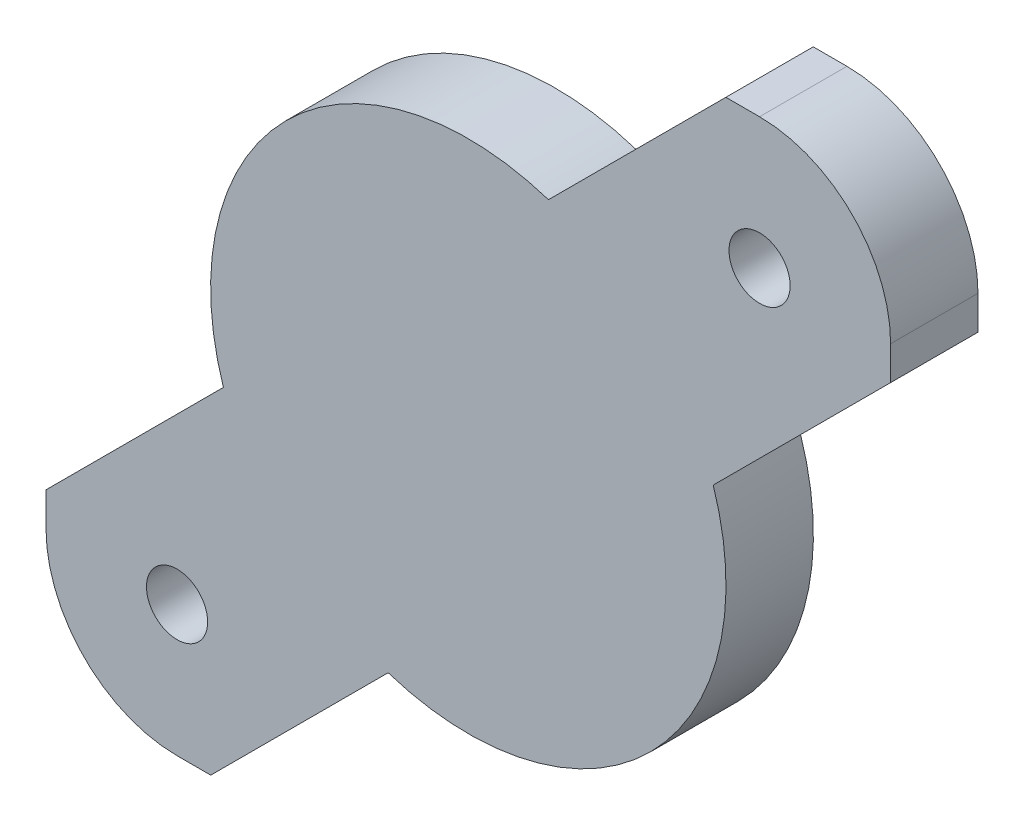
from build123d import *

# Parameters (mm, degrees)
SKETCH1_R           = 1.05
BOSS_EXTRUDE1_DEPTH = 3


with BuildPart() as part:
    # Sketch1 → Boss-Extrude1 (new body)
    with BuildSketch(Plane.XY):
        with BuildLine():
            Line((2.752454122, 8.409308372), (8.843145751, 14.5))
            Line((8.843145751, 14.5), (10, 14.5))
            ThreePointArc((10, 14.5), (13.181980515, 13.181980515), (14.5, 10))
            Line((14.5, 10), (14.5, 8.843145751))
            Line((14.5, 8.843145751), (8.409308372, 2.752454122))
            ThreePointArc((8.409308372, 2.752454122), (6.256695253, -6.256695253), (-2.752454122, -8.409308372))
            Line((-2.752454122, -8.409308372), (-8.843145751, -14.5))
            Line((-8.843145751, -14.5), (-10, -14.5))
            ThreePointArc((-10, -14.5), (-13.181980515, -13.181980515), (-14.5, -10))
            Line((-14.5, -10), (-14.5, -8.843145751))
            Line((-14.5, -8.843145751), (-8.409308372, -2.752454122))
            ThreePointArc((-8.409308372, -2.752454122), (-6.256695253, 6.256695253), (2.752454122, 8.409308372))
        make_face()
        with Locations((10, 10)):
            Circle(SKETCH1_R, mode=Mode.SUBTRACT)
        with Locations((-10, -10)):
            Circle(SKETCH1_R, mode=Mode.SUBTRACT)
    extrude(amount=BOSS_EXTRUDE1_DEPTH)


solid = part.part
